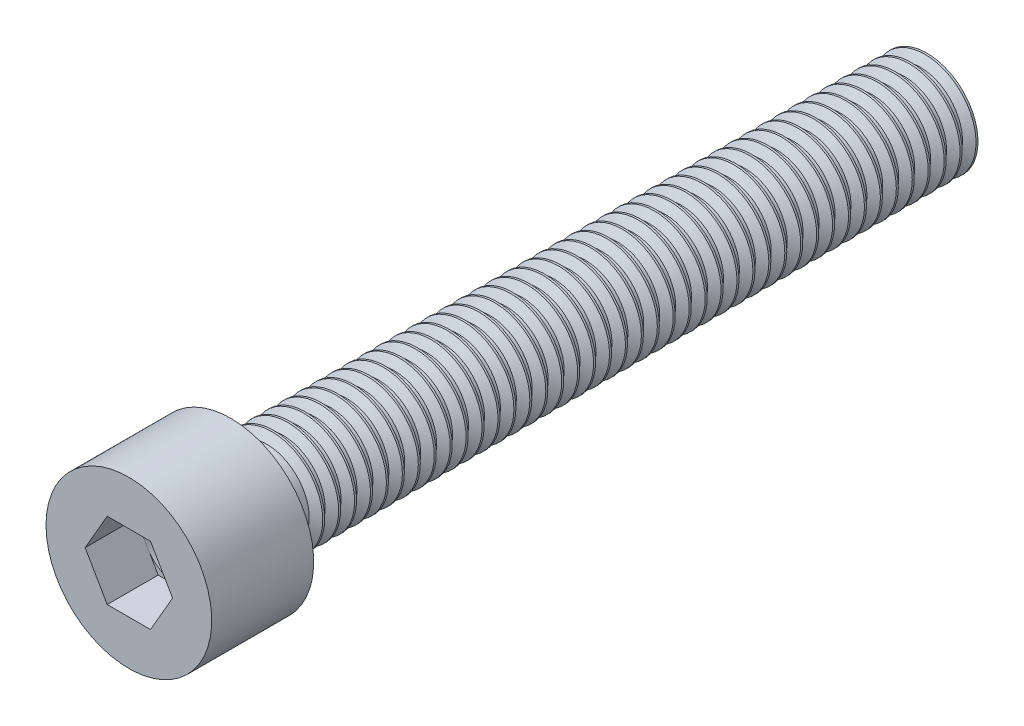
from build123d import *

# Parameters (mm, degrees)
SKETCH1_R          = 3.32812519
BASE_EXTRUDE_DEPTH = 55
LPATTERN1_COUNT    = 42
LPATTERN1_PITCH    = 1.249999972
SKETCH7_W          = 6.500000134
SKETCH7_H          = 8.00000038
CUT_EXTRUDE2_DEPTH = 4.00000019


with BuildPart() as part:
    # Sketch1 → Base-Extrude (new body)
    with BuildSketch(Plane.XY):
        Circle(SKETCH1_R)
    extrude(amount=BASE_EXTRUDE_DEPTH)

    # Boss-Sweep1: sweep along a path in Sketch4
    with BuildLine(Plane(origin=(0, 0, 0.5), x_dir=(-1, 0, 0), z_dir=(0, 0, -1))) as boss_sweep1_path:
        CenterArc((0, 0), 3.32812519, 0, 360)
    # Sketch2 → Boss-Sweep1 (sweep)
    with BuildSketch(Plane(origin=(0, 0, 0), x_dir=(1, 0, 0), z_dir=(0, 1, 0))):
        Polygon((3.32812519, 0), (4.00000019, -0.387907212), (4.00000019, -0.544157209), (3.32812519, -0.932064421), align=None)
    boss_sweep1 = sweep(path=boss_sweep1_path.line)

    # LPattern1: Boss-Sweep1 ×42
    with Locations(*[(0, 0, i * LPATTERN1_PITCH) for i in range(1, LPATTERN1_COUNT)]):
        add(boss_sweep1)

    # Sketch7 → Boss-Revolve2 (revolve)
    with BuildSketch(Plane(origin=(0, 0, 0), x_dir=(1, 0, 0), z_dir=(0, 1, 0))):
        with Locations((3.250000067, -59.00000019)):
            Rectangle(SKETCH7_W, SKETCH7_H)
    revolve(axis=Axis((0, 0, 0), (0, 0, 1)))

    # Sketch8 → Cut-Extrude2 (cut)
    with BuildSketch(Plane.XY.offset(63.00000038)):
        Polygon((-1.697949218, 3.000000026), (1.697949218, 3.000000026), (3.430000041, 0), (1.697949218, -3.000000026), (-1.697949218, -3.000000026), (-3.430000041, 0), align=None)
    extrude(amount=-CUT_EXTRUDE2_DEPTH, mode=Mode.SUBTRACT)

    # Sketch9 → Cut-Revolve1 (revolve, cut)
    with BuildSketch(Plane(origin=(0, 0, 0), x_dir=(1, 0, 0), z_dir=(0, 1, 0))):
        Polygon((0, -59.00000019), (3.000000026, -59.00000019), (3.000000026, -58.20000021), (0, -57.396152626), align=None)
    revolve(axis=Axis((0, 0, 0), (0, 0, 1)), mode=Mode.SUBTRACT)


solid = part.part
